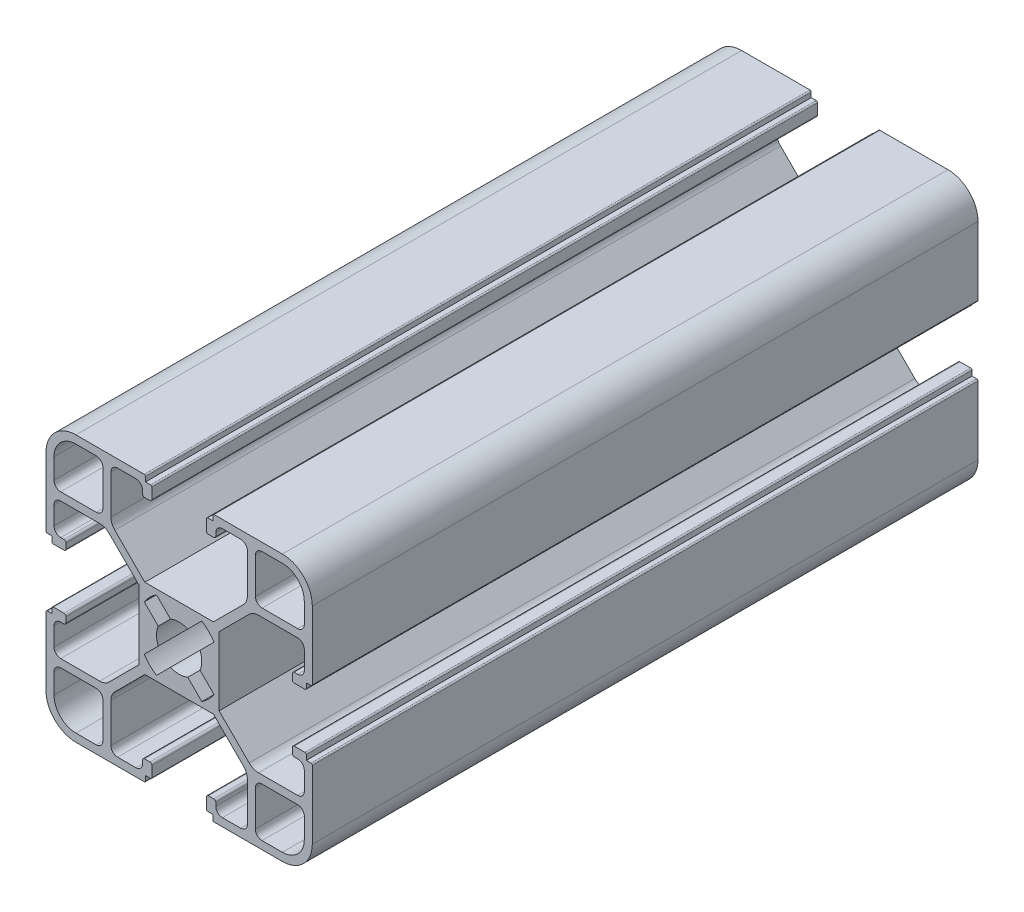
from build123d import *

# Parameters (mm, degrees)
EXTRUDE_1_DEPTH = 100


with BuildPart() as part:
    # 草图1 → 凸台-拉伸1 (new body)
    with BuildSketch(Plane.XY):
        with BuildLine():
            Line((-5.574392903, -5.605679436), (-10.087134603, -10.118421136))
            ThreePointArc((-10.087134603, -10.118421136), (-10.735981301, -10.551966639), (-11.501348165, -10.704207574))
            Line((-11.501348165, -10.704207574), (-17.374392903, -10.704207574))
            ThreePointArc((-17.374392903, -10.704207574), (-18.081499684, -10.411314355), (-18.374392903, -9.704207574))
            Line((-18.374392903, -9.704207574), (-18.374392903, -6.954207574))
            ThreePointArc((-18.374392903, -6.954207574), (-18.081499684, -6.247100792), (-17.374392903, -5.954207574))
            Line((-17.374392903, -5.954207574), (-16.874392903, -5.954207574))
            ThreePointArc((-16.874392903, -5.954207574), (-16.662260869, -5.866339608), (-16.574392903, -5.654207574))
            Line((-16.574392903, -5.654207574), (-16.574392903, -4.854207574))
            ThreePointArc((-16.574392903, -4.854207574), (-16.662260869, -4.642075539), (-16.874392903, -4.554207574))
            Line((-16.874392903, -4.554207574), (-18.474392903, -4.554207574))
            ThreePointArc((-18.474392903, -4.554207574), (-18.61581426, -4.612786217), (-18.674392903, -4.754207574))
            Line((-18.674392903, -4.754207574), (-18.674392903, -5.504207574))
            Line((-18.674392903, -5.504207574), (-19.374392903, -5.504207574))
            ThreePointArc((-19.374392903, -5.504207574), (-19.51581426, -5.562786217), (-19.574392903, -5.704207574))
            Line((-19.574392903, -5.704207574), (-19.574392903, -15.954207574))
            ThreePointArc((-19.574392903, -15.954207574), (-18.256373419, -19.136188089), (-15.074392903, -20.454207574))
            Line((-15.074392903, -20.454207574), (-4.824392903, -20.454207574))
            ThreePointArc((-4.824392903, -20.454207574), (-4.682971547, -20.39562893), (-4.624392903, -20.254207574))
            Line((-4.624392903, -20.254207574), (-4.624392903, -19.554207574))
            Line((-4.624392903, -19.554207574), (-3.874392903, -19.554207574))
            ThreePointArc((-3.874392903, -19.554207574), (-3.732971547, -19.49562893), (-3.674392903, -19.354207574))
            Line((-3.674392903, -19.354207574), (-3.674392903, -17.754207574))
            ThreePointArc((-3.674392903, -17.754207574), (-3.762260869, -17.542075539), (-3.974392903, -17.454207574))
            Line((-3.974392903, -17.454207574), (-4.774392903, -17.454207574))
            ThreePointArc((-4.774392903, -17.454207574), (-4.986524938, -17.542075539), (-5.074392903, -17.754207574))
            Line((-5.074392903, -17.754207574), (-5.074392903, -18.254207574))
            ThreePointArc((-5.074392903, -18.254207574), (-5.367286122, -18.961314355), (-6.074392903, -19.254207574))
            Line((-6.074392903, -19.254207574), (-8.824392903, -19.254207574))
            ThreePointArc((-8.824392903, -19.254207574), (-9.531499684, -18.961314355), (-9.824392903, -18.254207574))
            Line((-9.824392903, -18.254207574), (-9.824392903, -12.381162836))
            ThreePointArc((-9.824392903, -12.381162836), (-9.672151968, -11.615795971), (-9.238606466, -10.966949273))
            Line((-9.238606466, -10.966949273), (-4.725864766, -6.454207574))
            Line((-4.725864766, -6.454207574), (5.577078959, -6.454207574))
            Line((5.577078959, -6.454207574), (10.089820659, -10.966949273))
            ThreePointArc((10.089820659, -10.966949273), (10.523366162, -11.615795971), (10.675607097, -12.381162836))
            Line((10.675607097, -12.381162836), (10.675607097, -18.254207574))
            ThreePointArc((10.675607097, -18.254207574), (10.382713878, -18.961314355), (9.675607097, -19.254207574))
            Line((9.675607097, -19.254207574), (6.925607097, -19.254207574))
            ThreePointArc((6.925607097, -19.254207574), (6.218500316, -18.961314355), (5.925607097, -18.254207574))
            Line((5.925607097, -18.254207574), (5.925607097, -17.754207574))
            ThreePointArc((5.925607097, -17.754207574), (5.837739131, -17.542075539), (5.625607097, -17.454207574))
            Line((5.625607097, -17.454207574), (4.825607097, -17.454207574))
            ThreePointArc((4.825607097, -17.454207574), (4.613475062, -17.542075539), (4.525607097, -17.754207574))
            Line((4.525607097, -17.754207574), (4.525607097, -19.354207574))
            ThreePointArc((4.525607097, -19.354207574), (4.584185741, -19.49562893), (4.725607097, -19.554207574))
            Line((4.725607097, -19.554207574), (5.475607097, -19.554207574))
            Line((5.475607097, -19.554207574), (5.475607097, -20.254207574))
            ThreePointArc((5.475607097, -20.254207574), (5.534185741, -20.39562893), (5.675607097, -20.454207574))
            Line((5.675607097, -20.454207574), (15.925607097, -20.454207574))
            ThreePointArc((15.925607097, -20.454207574), (19.107587612, -19.136188089), (20.425607097, -15.954207574))
            Line((20.425607097, -15.954207574), (20.425607097, -5.704207574))
            ThreePointArc((20.425607097, -5.704207574), (20.367028453, -5.562786217), (20.225607097, -5.504207574))
            Line((20.225607097, -5.504207574), (19.525607097, -5.504207574))
            Line((19.525607097, -5.504207574), (19.525607097, -4.754207574))
            ThreePointArc((19.525607097, -4.754207574), (19.467028453, -4.612786217), (19.325607097, -4.554207574))
            Line((19.325607097, -4.554207574), (17.725607097, -4.554207574))
            ThreePointArc((17.725607097, -4.554207574), (17.513475062, -4.642075539), (17.425607097, -4.854207574))
            Line((17.425607097, -4.854207574), (17.425607097, -5.654207574))
            ThreePointArc((17.425607097, -5.654207574), (17.513475062, -5.866339608), (17.725607097, -5.954207574))
            Line((17.725607097, -5.954207574), (18.225607097, -5.954207574))
            ThreePointArc((18.225607097, -5.954207574), (18.932713878, -6.247100792), (19.225607097, -6.954207574))
            Line((19.225607097, -6.954207574), (19.225607097, -9.704207574))
            ThreePointArc((19.225607097, -9.704207574), (18.932713878, -10.411314355), (18.225607097, -10.704207574))
            Line((18.225607097, -10.704207574), (12.352562359, -10.704207574))
            ThreePointArc((12.352562359, -10.704207574), (11.587195494, -10.551966639), (10.938348797, -10.118421136))
            Line((10.938348797, -10.118421136), (6.425607097, -5.605679436))
            Line((6.425607097, -5.605679436), (6.425607097, 4.697264289))
            Line((6.425607097, 4.697264289), (10.938348797, 9.210005989))
            ThreePointArc((10.938348797, 9.210005989), (11.587195494, 9.643551491), (12.352562359, 9.795792426))
            Line((12.352562359, 9.795792426), (18.225607097, 9.795792426))
            ThreePointArc((18.225607097, 9.795792426), (18.932713878, 9.502899208), (19.225607097, 8.795792426))
            Line((19.225607097, 8.795792426), (19.225607097, 6.045792426))
            ThreePointArc((19.225607097, 6.045792426), (18.932713878, 5.338685645), (18.225607097, 5.045792426))
            Line((18.225607097, 5.045792426), (17.725607097, 5.045792426))
            ThreePointArc((17.725607097, 5.045792426), (17.513475062, 4.957924461), (17.425607097, 4.745792426))
            Line((17.425607097, 4.745792426), (17.425607097, 3.945792426))
            ThreePointArc((17.425607097, 3.945792426), (17.513475062, 3.733660392), (17.725607097, 3.645792426))
            Line((17.725607097, 3.645792426), (19.325607097, 3.645792426))
            ThreePointArc((19.325607097, 3.645792426), (19.467028453, 3.70437107), (19.525607097, 3.845792426))
            Line((19.525607097, 3.845792426), (19.525607097, 4.595792426))
            Line((19.525607097, 4.595792426), (20.225607097, 4.595792426))
            ThreePointArc((20.225607097, 4.595792426), (20.367028453, 4.65437107), (20.425607097, 4.795792426))
            Line((20.425607097, 4.795792426), (20.425607097, 15.045792426))
            ThreePointArc((20.425607097, 15.045792426), (19.107587612, 18.227772942), (15.925607097, 19.545792426))
            Line((15.925607097, 19.545792426), (5.675607097, 19.545792426))
            ThreePointArc((5.675607097, 19.545792426), (5.534185741, 19.487213783), (5.475607097, 19.345792426))
            Line((5.475607097, 19.345792426), (5.475607097, 18.645792426))
            Line((5.475607097, 18.645792426), (4.725607097, 18.645792426))
            ThreePointArc((4.725607097, 18.645792426), (4.584185741, 18.587213783), (4.525607097, 18.445792426))
            Line((4.525607097, 18.445792426), (4.525607097, 16.845792426))
            ThreePointArc((4.525607097, 16.845792426), (4.613475062, 16.633660392), (4.825607097, 16.545792426))
            Line((4.825607097, 16.545792426), (5.625607097, 16.545792426))
            ThreePointArc((5.625607097, 16.545792426), (5.837739131, 16.633660392), (5.925607097, 16.845792426))
            Line((5.925607097, 16.845792426), (5.925607097, 17.345792426))
            ThreePointArc((5.925607097, 17.345792426), (6.218500316, 18.052899208), (6.925607097, 18.345792426))
            Line((6.925607097, 18.345792426), (9.675607097, 18.345792426))
            ThreePointArc((9.675607097, 18.345792426), (10.382713878, 18.052899208), (10.675607097, 17.345792426))
            Line((10.675607097, 17.345792426), (10.675607097, 11.472747689))
            ThreePointArc((10.675607097, 11.472747689), (10.523366162, 10.707380824), (10.089820659, 10.058534126))
            Line((10.089820659, 10.058534126), (5.577078959, 5.545792426))
            Line((5.577078959, 5.545792426), (-4.725864766, 5.545792426))
            Line((-4.725864766, 5.545792426), (-9.238606466, 10.058534126))
            ThreePointArc((-9.238606466, 10.058534126), (-9.672151968, 10.707380824), (-9.824392903, 11.472747689))
            Line((-9.824392903, 11.472747689), (-9.824392903, 17.345792426))
            ThreePointArc((-9.824392903, 17.345792426), (-9.531499684, 18.052899208), (-8.824392903, 18.345792426))
            Line((-8.824392903, 18.345792426), (-6.074392903, 18.345792426))
            ThreePointArc((-6.074392903, 18.345792426), (-5.367286122, 18.052899208), (-5.074392903, 17.345792426))
            Line((-5.074392903, 17.345792426), (-5.074392903, 16.845792426))
            ThreePointArc((-5.074392903, 16.845792426), (-4.986524938, 16.633660392), (-4.774392903, 16.545792426))
            Line((-4.774392903, 16.545792426), (-3.974392903, 16.545792426))
            ThreePointArc((-3.974392903, 16.545792426), (-3.762260869, 16.633660392), (-3.674392903, 16.845792426))
            Line((-3.674392903, 16.845792426), (-3.674392903, 18.445792426))
            ThreePointArc((-3.674392903, 18.445792426), (-3.732971547, 18.587213783), (-3.874392903, 18.645792426))
            Line((-3.874392903, 18.645792426), (-4.624392903, 18.645792426))
            Line((-4.624392903, 18.645792426), (-4.624392903, 19.345792426))
            ThreePointArc((-4.624392903, 19.345792426), (-4.682971547, 19.487213783), (-4.824392903, 19.545792426))
            Line((-4.824392903, 19.545792426), (-15.074392903, 19.545792426))
            ThreePointArc((-15.074392903, 19.545792426), (-18.256373419, 18.227772942), (-19.574392903, 15.045792426))
            Line((-19.574392903, 15.045792426), (-19.574392903, 4.795792426))
            ThreePointArc((-19.574392903, 4.795792426), (-19.51581426, 4.65437107), (-19.374392903, 4.595792426))
            Line((-19.374392903, 4.595792426), (-18.674392903, 4.595792426))
            Line((-18.674392903, 4.595792426), (-18.674392903, 3.845792426))
            ThreePointArc((-18.674392903, 3.845792426), (-18.61581426, 3.70437107), (-18.474392903, 3.645792426))
            Line((-18.474392903, 3.645792426), (-16.874392903, 3.645792426))
            ThreePointArc((-16.874392903, 3.645792426), (-16.662260869, 3.733660392), (-16.574392903, 3.945792426))
            Line((-16.574392903, 3.945792426), (-16.574392903, 4.745792426))
            ThreePointArc((-16.574392903, 4.745792426), (-16.662260869, 4.957924461), (-16.874392903, 5.045792426))
            Line((-16.874392903, 5.045792426), (-17.374392903, 5.045792426))
            ThreePointArc((-17.374392903, 5.045792426), (-18.081499684, 5.338685645), (-18.374392903, 6.045792426))
            Line((-18.374392903, 6.045792426), (-18.374392903, 8.795792426))
            ThreePointArc((-18.374392903, 8.795792426), (-18.081499684, 9.502899208), (-17.374392903, 9.795792426))
            Line((-17.374392903, 9.795792426), (-11.501348165, 9.795792426))
            ThreePointArc((-11.501348165, 9.795792426), (-10.735981301, 9.643551491), (-10.087134603, 9.210005989))
            Line((-10.087134603, 9.210005989), (-5.574392903, 4.697264289))
            Line((-5.574392903, 4.697264289), (-5.574392903, -5.605679436))
        make_face()
        with BuildLine():
            Line((-15.074392903, -19.254207574), (-12.024392903, -19.254207574))
            ThreePointArc((-12.024392903, -19.254207574), (-11.317286122, -18.961314355), (-11.024392903, -18.254207574))
            Line((-11.024392903, -18.254207574), (-11.024392903, -12.904207574))
            ThreePointArc((-11.024392903, -12.904207574), (-11.317286122, -12.197100792), (-12.024392903, -11.904207574))
            Line((-12.024392903, -11.904207574), (-17.374392903, -11.904207574))
            ThreePointArc((-17.374392903, -11.904207574), (-18.081499684, -12.197100792), (-18.374392903, -12.904207574))
            Line((-18.374392903, -12.904207574), (-18.374392903, -15.954207574))
            ThreePointArc((-18.374392903, -15.954207574), (-17.407845281, -18.287659952), (-15.074392903, -19.254207574))
        make_face(mode=Mode.SUBTRACT)
        with BuildLine():
            Line((-12.024392903, 18.345792426), (-15.074392903, 18.345792426))
            ThreePointArc((-15.074392903, 18.345792426), (-17.407845281, 17.379244804), (-18.374392903, 15.045792426))
            Line((-18.374392903, 15.045792426), (-18.374392903, 11.995792426))
            ThreePointArc((-18.374392903, 11.995792426), (-18.081499684, 11.288685645), (-17.374392903, 10.995792426))
            Line((-17.374392903, 10.995792426), (-12.024392903, 10.995792426))
            ThreePointArc((-12.024392903, 10.995792426), (-11.317286122, 11.288685645), (-11.024392903, 11.995792426))
            Line((-11.024392903, 11.995792426), (-11.024392903, 17.345792426))
            ThreePointArc((-11.024392903, 17.345792426), (-11.317286122, 18.052899208), (-12.024392903, 18.345792426))
        make_face(mode=Mode.SUBTRACT)
        with BuildLine():
            Line((15.925607097, 18.345792426), (12.875607097, 18.345792426))
            ThreePointArc((12.875607097, 18.345792426), (12.168500316, 18.052899208), (11.875607097, 17.345792426))
            Line((11.875607097, 17.345792426), (11.875607097, 11.995792426))
            ThreePointArc((11.875607097, 11.995792426), (12.168500316, 11.288685645), (12.875607097, 10.995792426))
            Line((12.875607097, 10.995792426), (18.225607097, 10.995792426))
            ThreePointArc((18.225607097, 10.995792426), (18.932713878, 11.288685645), (19.225607097, 11.995792426))
            Line((19.225607097, 11.995792426), (19.225607097, 15.045792426))
            ThreePointArc((19.225607097, 15.045792426), (18.259059475, 17.379244804), (15.925607097, 18.345792426))
        make_face(mode=Mode.SUBTRACT)
        with BuildLine():
            Line((12.875607097, -19.254207574), (15.925607097, -19.254207574))
            ThreePointArc((15.925607097, -19.254207574), (18.259059475, -18.287659952), (19.225607097, -15.954207574))
            Line((19.225607097, -15.954207574), (19.225607097, -12.904207574))
            ThreePointArc((19.225607097, -12.904207574), (18.932713878, -12.197100792), (18.225607097, -11.904207574))
            Line((18.225607097, -11.904207574), (12.875607097, -11.904207574))
            ThreePointArc((12.875607097, -11.904207574), (12.168500316, -12.197100792), (11.875607097, -12.904207574))
            Line((11.875607097, -12.904207574), (11.875607097, -18.254207574))
            ThreePointArc((11.875607097, -18.254207574), (12.168500316, -18.961314355), (12.875607097, -19.254207574))
        make_face(mode=Mode.SUBTRACT)
        with BuildLine():
            Line((-2.977913623, -5.696205924), (-0.876640077, -3.594932378))
            ThreePointArc((-0.876640077, -3.594932378), (0.425607097, -3.854207574), (1.72785427, -3.594932378))
            Line((1.72785427, -3.594932378), (3.829127816, -5.696205924))
            ThreePointArc((3.829127816, -5.696205924), (4.845024479, -4.873624956), (5.667605448, -3.857728293))
            Line((5.667605448, -3.857728293), (3.566331901, -1.756454747))
            ThreePointArc((3.566331901, -1.756454747), (3.825607097, -0.454207574), (3.566331901, 0.8480396))
            Line((3.566331901, 0.8480396), (5.667605448, 2.949313146))
            ThreePointArc((5.667605448, 2.949313146), (4.845024479, 3.965209809), (3.829127816, 4.787790777))
            Line((3.829127816, 4.787790777), (1.72785427, 2.686517231))
            ThreePointArc((1.72785427, 2.686517231), (0.425607097, 2.945792426), (-0.876640077, 2.686517231))
            Line((-0.876640077, 2.686517231), (-2.977913623, 4.787790777))
            ThreePointArc((-2.977913623, 4.787790777), (-3.993810286, 3.965209809), (-4.816391254, 2.949313146))
            Line((-4.816391254, 2.949313146), (-2.715117708, 0.8480396))
            ThreePointArc((-2.715117708, 0.8480396), (-2.974392903, -0.454207574), (-2.715117708, -1.756454747))
            Line((-2.715117708, -1.756454747), (-4.816391254, -3.857728293))
            ThreePointArc((-4.816391254, -3.857728293), (-3.993810286, -4.873624956), (-2.977913623, -5.696205924))
        make_face(mode=Mode.SUBTRACT)
    extrude(amount=EXTRUDE_1_DEPTH)


solid = part.part
